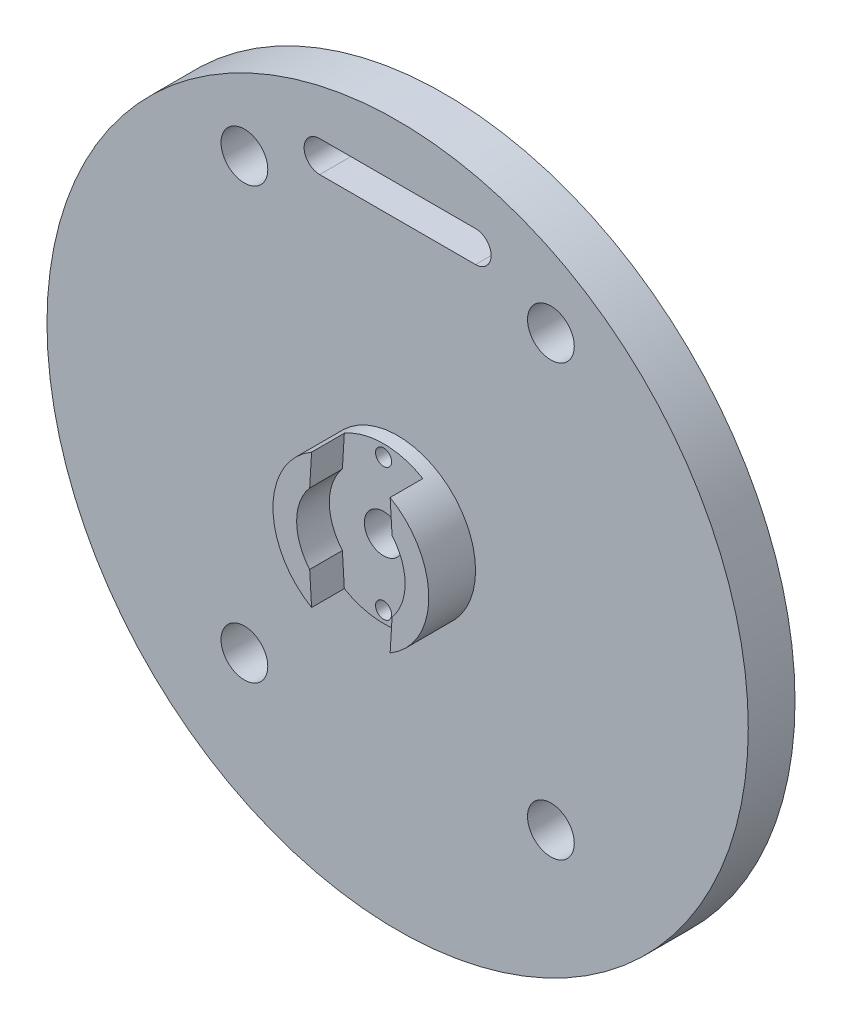
from build123d import *

# Parameters (mm, degrees)
ESQUISSE1_R             = 22.5
BOSS_EXTRU_1_DEPTH      = 3
ESQUISSE2_R             = 5
BOSS_EXTRU_2_DEPTH      = 3
ENL_V_MAT_EXTRU_3_DEPTH = 10
ESQUISSE10_R            = 1.5
ENL_V_MAT_EXTRU_4_DEPTH = 10
ENL_V_MAT_EXTRU_5_DEPTH = 2.1
ESQUISSE12_R            = 0.515
ESQUISSE12_R_2          = 1.235
ENL_V_MAT_EXTRU_6_DEPTH = 33.057916339
ESQUISSE13_R            = 1.5
ENL_V_MAT_EXTRU_7_DEPTH = 33.380549717


with BuildPart() as part:
    # Esquisse1 → Boss.-Extru.1 (new body)
    with BuildSketch(Plane.XY):
        Circle(ESQUISSE1_R)
    extrude(amount=BOSS_EXTRU_1_DEPTH)

    # Esquisse2 → Boss.-Extru.2 (add)
    with BuildSketch(Plane.XY.offset(3)):
        Circle(ESQUISSE2_R)
    extrude(amount=BOSS_EXTRU_2_DEPTH)

    # Esquisse6 → Enlèv. mat.-Extru.3 (cut)
    with BuildSketch(Plane(origin=(0, 0, 0), x_dir=(-1, 0, 0), z_dir=(0, 0, -1))):
        with BuildLine():
            Line((-5, 19), (5, 19))
            ThreePointArc((5, 19), (6, 18), (5, 17))
            Line((5, 17), (-5, 17))
            ThreePointArc((-5, 17), (-6, 18), (-5, 19))
        make_face()
    extrude(amount=-ENL_V_MAT_EXTRU_3_DEPTH, mode=Mode.SUBTRACT)

    # Esquisse10 → Enlèv. mat.-Extru.4 (cut)
    with BuildSketch(Plane(origin=(0, 0, 0), x_dir=(-1, 0, 0), z_dir=(0, 0, -1))):
        with Locations((-9.835, -12)):
            Circle(ESQUISSE10_R)
        with Locations((9.831247904, -12)):
            Circle(ESQUISSE10_R)
    extrude(amount=-ENL_V_MAT_EXTRU_4_DEPTH, mode=Mode.SUBTRACT)

    # Esquisse11 → Enlèv. mat.-Extru.5 (cut)
    with BuildSketch(Plane.XY.offset(6)):
        with BuildLine():
            Line((2.516635816, 4.378246701), (2.643897714, 2.262786971))
            ThreePointArc((2.643897714, 2.262786971), (3.48, 0), (2.643897714, -2.262786971))
            Line((2.643897714, -2.262786971), (2.516635816, -4.378246701))
            ThreePointArc((2.516635816, -4.378246701), (0, -5.05), (-2.516635816, -4.378246701))
            Line((-2.516635816, -4.378246701), (-2.643897714, -2.262786971))
            ThreePointArc((-2.643897714, -2.262786971), (-3.48, 0), (-2.643897714, 2.262786971))
            Line((-2.643897714, 2.262786971), (-2.516635816, 4.378246701))
            ThreePointArc((-2.516635816, 4.378246701), (0, 5.05), (2.516635816, 4.378246701))
        make_face()
    extrude(amount=-ENL_V_MAT_EXTRU_5_DEPTH, mode=Mode.SUBTRACT)

    # Esquisse12 → Enlèv. mat.-Extru.6 (cut, through all)
    with BuildSketch(Plane.XY.offset(3.9)):
        with Locations((0, 4.25)):
            Circle(ESQUISSE12_R)
        Circle(ESQUISSE12_R_2)
        with Locations((0, -4.25)):
            Circle(ESQUISSE12_R)
    extrude(amount=-ENL_V_MAT_EXTRU_6_DEPTH, mode=Mode.SUBTRACT)

    # Esquisse13 → Enlèv. mat.-Extru.7 (cut, through all)
    with BuildSketch(Plane(origin=(0, 0, 0), x_dir=(-1, 0, 0), z_dir=(0, 0, -1))):
        with Locations((-9.835, 15.615)):
            Circle(ESQUISSE13_R)
        with Locations((9.831247904, 15.615)):
            Circle(ESQUISSE13_R)
    extrude(amount=-ENL_V_MAT_EXTRU_7_DEPTH, mode=Mode.SUBTRACT)


solid = part.part
